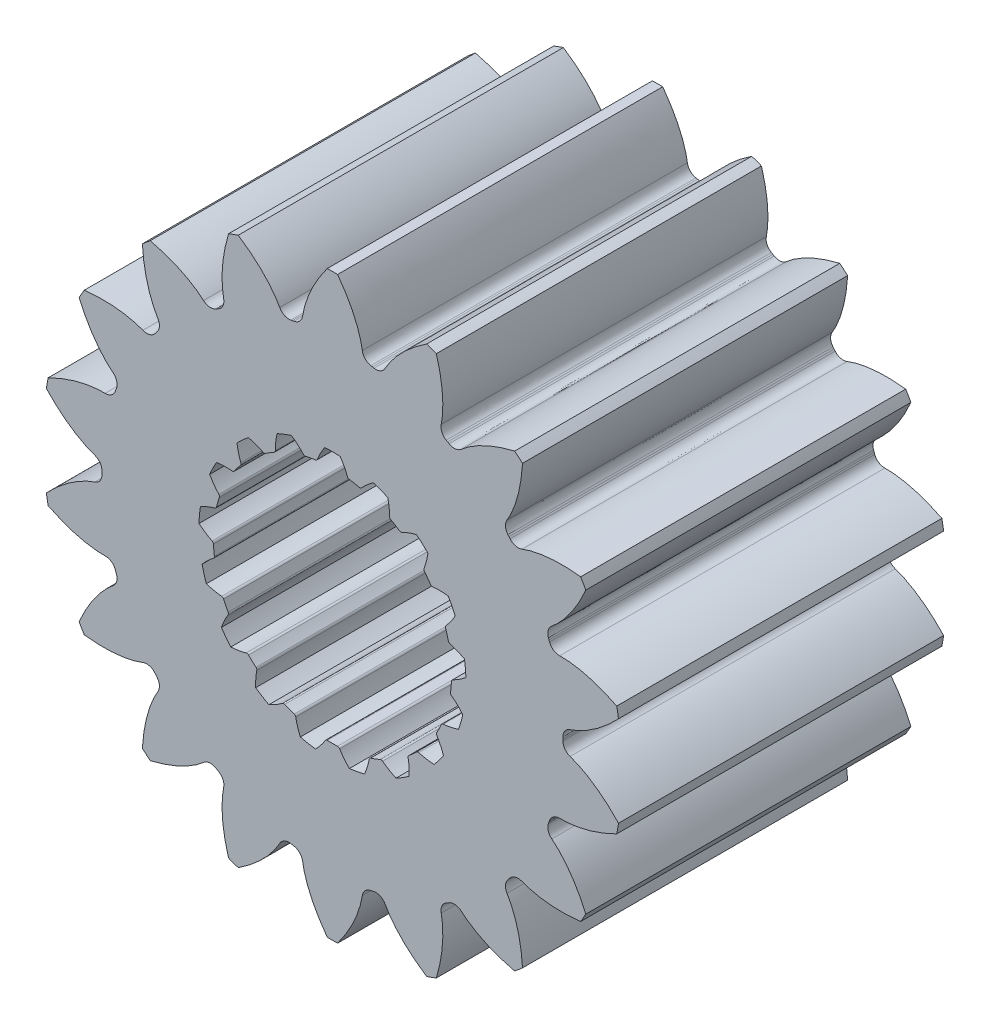
from build123d import *

# Parameters (mm, degrees)
BOSS_EXTRUDE1_DEPTH      = 9
BOSS_EXTRUDE1_DEPTH_BACK = 9
SKETCH1_R                = 16.0345
SKETCH1_R_2              = 5
CUT_EXTRUDE1_START       = -9
CUT_EXTRUDE1_DEPTH       = 18
CIRPATTERN1_COUNT        = 18
CUT_EXTRUDE2_DEPTH       = 18


with BuildPart() as part:
    # Sketch1 → Boss-Extrude1 (new, two sides: drawn at the far end of the back side and taken through both)
    with BuildSketch(Plane.XY.offset(-BOSS_EXTRUDE1_DEPTH_BACK)):
        Circle(SKETCH1_R)
        Circle(SKETCH1_R_2, mode=Mode.SUBTRACT)
    extrude(amount=BOSS_EXTRUDE1_DEPTH + BOSS_EXTRUDE1_DEPTH_BACK)

    # Sketch2 → Cut-Extrude1 (cut)
    with BuildSketch(Plane.XY.offset(CUT_EXTRUDE1_START)):
        with BuildLine():
            Line((5.214823842, 15.16280985), (5.423416795, 15.769322244))
            ThreePointArc((5.423416795, 15.769322244), (2.895736173, 16.422535912), (0.297081112, 16.673233537))
            Line((0.297081112, 16.673233537), (0.285654915, 16.031955324))
            add(Edge.make_bspline(
                [(0.285654915, 16.031955324), (0.767185844, 15.385565398), (1.123566803, 14.774160551), (1.369184958, 14.22072338), (1.523629879, 13.744240633), (1.609966452, 13.358037963), (1.652753118, 13.069342232)],
                knots=[0, 0, 0, 0, 0, 0, 0, 1, 1, 1, 1, 1, 1, 1], degree=6))
            add(Edge.make_bspline(
                [(1.652753118, 13.069342232), (1.65690486, 13.041303758), (1.668991922, 12.986299485), (1.698350668, 12.908124296), (1.737718721, 12.836284444), (1.785987822, 12.771662534), (1.84229624, 12.714839563), (1.905620083, 12.666581458), (1.974800727, 12.627632859), (2.048568857, 12.598635126), (2.099908792, 12.586265226), (2.125873398, 12.581878812)],
                knots=[0, 0, 0, 0, 0.117046642, 0.231959645, 0.343942671, 0.454480363, 0.564216465, 0.673478121, 0.782453612, 0.891264558, 1, 1, 1, 1], degree=3))
            add(Edge.make_bspline(
                [(2.125873398, 12.581878812), (2.155863162, 12.576811649), (2.185834809, 12.57163726), (2.215787573, 12.56635578)],
                knots=[0, 0, 0, 0, 1, 1, 1, 1], degree=3))
            add(Edge.make_bspline(
                [(2.215787573, 12.56635578), (2.245740337, 12.561074299), (2.275674218, 12.555685727), (2.30558845, 12.5501902)],
                knots=[0, 0, 0, 0, 1, 1, 1, 1], degree=3))
            add(Edge.make_bspline(
                [(2.30558845, 12.5501902), (2.33148744, 12.545431662), (2.383961954, 12.539496274), (2.46319913, 12.541515043), (2.541528876, 12.554453581), (2.617539067, 12.578143336), (2.689886274, 12.612280849), (2.757346386, 12.656496577), (2.818910931, 12.710539288), (2.873236618, 12.773958654), (2.90340731, 12.821511744), (2.916898394, 12.846439312)],
                knots=[0, 0, 0, 0, 0.108735442, 0.217546388, 0.326521879, 0.435783535, 0.545519637, 0.656057329, 0.768040355, 0.882953358, 1, 1, 1, 1], degree=3))
            add(Edge.make_bspline(
                [(2.916898394, 12.846439312), (3.055844464, 13.103090659), (3.269063397, 13.43647361), (3.577160847, 13.831397658), (3.997253075, 14.267452127), (4.541254406, 14.720095284), (5.214823842, 15.16280985)],
                knots=[0, 0, 0, 0, 0, 0, 0, 1, 1, 1, 1, 1, 1, 1], degree=6))
        make_face()
    cut_extrude1 = extrude(amount=CUT_EXTRUDE1_DEPTH, mode=Mode.SUBTRACT)

    # CirPattern1: Cut-Extrude1 ×18 about axis
    cirpattern1_axis = Axis((0, 0, -12.5), (0, 0, 1))
    for i in range(1, CIRPATTERN1_COUNT):
        add(cut_extrude1.rotate(cirpattern1_axis, i * 360 / CIRPATTERN1_COUNT), mode=Mode.SUBTRACT)

    # Sketch3 → Cut-Extrude2 (cut)
    with BuildSketch(Plane.XY.offset(9)):
        with BuildLine():
            ThreePointArc((3.065392679, 6.726988256), (2.670452404, 6.893309146), (2.26653836, 7.036466068))
            add(Edge.make_bspline(
                [(2.26653836, 7.036466068), (2.126776613, 6.938773232), (1.999922141, 6.840575902), (1.885666526, 6.743095462), (1.783571022, 6.647504303), (1.693075613, 6.554906138), (1.613512451, 6.466320269)],
                knots=[0, 0, 0, 0, 0, 0, 0, 1, 1, 1, 1, 1, 1, 1], degree=6))
            add(Edge.make_bspline(
                [(1.613512451, 6.466320269), (1.598123188, 6.449084984), (1.558003244, 6.423029011), (1.510179469, 6.420973803), (1.487713761, 6.426226045)],
                knots=[0, 0, 0, 0, 0.500434337, 1, 1, 1, 1], degree=3))
            ThreePointArc((1.487713761, 6.426226045), (1.350174179, 6.456524672), (1.212019072, 6.483879919))
            ThreePointArc((1.212019072, 6.483879919), (1.073311415, 6.508279292), (0.934114448, 6.529711692))
            add(Edge.make_bspline(
                [(0.934114448, 6.529711692), (0.911268471, 6.532929671), (0.867416555, 6.552122036), (0.839418325, 6.590911503), (0.831294368, 6.61254217)],
                knots=[0, 0, 0, 0, 0.499565663, 1, 1, 1, 1], degree=3))
            add(Edge.make_bspline(
                [(0.831294368, 6.61254217), (0.789104836, 6.723887562), (0.738170695, 6.842923492), (0.677500983, 6.968940743), (0.606174791, 7.101112435), (0.523359486, 7.238503839), (0.428326261, 7.380087462)],
                knots=[0, 0, 0, 0, 0, 0, 0, 1, 1, 1, 1, 1, 1, 1], degree=6))
            ThreePointArc((0.428326261, 7.380087462), (-2.6613e-05, 7.39250819), (-0.428379487, 7.380087462))
            add(Edge.make_bspline(
                [(-0.428379487, 7.380087462), (-0.523412712, 7.238503839), (-0.606228017, 7.101112435), (-0.677554209, 6.968940743), (-0.738223921, 6.842923492), (-0.789158063, 6.723887562), (-0.831347594, 6.61254217)],
                knots=[0, 0, 0, 0, 0, 0, 0, 1, 1, 1, 1, 1, 1, 1], degree=6))
            add(Edge.make_bspline(
                [(-0.831347594, 6.61254217), (-0.839471551, 6.590911503), (-0.867469782, 6.552122036), (-0.911321697, 6.532929671), (-0.934167675, 6.529711692)],
                knots=[0, 0, 0, 0, 0.500434337, 1, 1, 1, 1], degree=3))
            ThreePointArc((-0.934167675, 6.529711692), (-1.073364642, 6.508279292), (-1.212072298, 6.483879919))
            ThreePointArc((-1.212072298, 6.483879919), (-1.350227406, 6.456524672), (-1.487766988, 6.426226045))
            add(Edge.make_bspline(
                [(-1.487766988, 6.426226045), (-1.510232695, 6.420973803), (-1.55805647, 6.423029011), (-1.598176415, 6.449084984), (-1.613565678, 6.466320269)],
                knots=[0, 0, 0, 0, 0.499565663, 1, 1, 1, 1], degree=3))
            add(Edge.make_bspline(
                [(-1.613565678, 6.466320269), (-1.693128839, 6.554906138), (-1.783624249, 6.647504303), (-1.885719752, 6.743095462), (-1.999975367, 6.840575902), (-2.126829839, 6.938773232), (-2.266591586, 7.036466068)],
                knots=[0, 0, 0, 0, 0, 0, 0, 1, 1, 1, 1, 1, 1, 1], degree=6))
            ThreePointArc((-2.266591586, 7.036466068), (-2.67050563, 6.893309146), (-3.065445906, 6.726988256))
            add(Edge.make_bspline(
                [(-3.065445906, 6.726988256), (-3.102915845, 6.560635499), (-3.130507317, 6.402605491), (-3.149271088, 6.253593067), (-3.160321228, 6.114169052), (-3.164815163, 5.984771819), (-3.163933134, 5.865704717)],
                knots=[0, 0, 0, 0, 0, 0, 0, 1, 1, 1, 1, 1, 1, 1], degree=6))
            add(Edge.make_bspline(
                [(-3.163933134, 5.865704717), (-3.1636946, 5.842600008), (-3.175789801, 5.79631578), (-3.209747413, 5.762578293), (-3.229888184, 5.751324698)],
                knots=[0, 0, 0, 0, 0.500434337, 1, 1, 1, 1], degree=3))
            ThreePointArc((-3.229888184, 5.751324698), (-3.351943214, 5.681055836), (-3.472470182, 5.608197114))
            ThreePointArc((-3.472470182, 5.608197114), (-3.591414128, 5.532781724), (-3.708720842, 5.454844068))
            add(Edge.make_bspline(
                [(-3.708720842, 5.454844068), (-3.727772162, 5.441830948), (-3.773108931, 5.426471433), (-3.819932168, 5.436274908), (-3.840508331, 5.44678709)],
                knots=[0, 0, 0, 0, 0.499565663, 1, 1, 1, 1], degree=3))
            add(Edge.make_bspline(
                [(-3.840508331, 5.44678709), (-3.946699677, 5.500649424), (-4.064534449, 5.554303929), (-4.19426718, 5.60655888), (-4.336021365, 5.656182794), (-4.489782604, 5.701923957), (-4.655397275, 5.742532048)],
                knots=[0, 0, 0, 0, 0, 0, 0, 1, 1, 1, 1, 1, 1, 1], degree=6))
            ThreePointArc((-4.655397275, 5.742532048), (-4.980321659, 5.463131611), (-5.288510462, 5.165373117))
            add(Edge.make_bspline(
                [(-5.288510462, 5.165373117), (-5.263356593, 4.996718087), (-5.231997851, 4.839392304), (-5.19566505, 4.6936641), (-5.155603235, 4.559663308), (-5.113050033, 4.437380585), (-5.069215567, 4.326672444)],
                knots=[0, 0, 0, 0, 0, 0, 0, 1, 1, 1, 1, 1, 1, 1], degree=6))
            add(Edge.make_bspline(
                [(-5.069215567, 4.326672444), (-5.060646757, 4.305214113), (-5.055205405, 4.257686065), (-5.074682549, 4.213959892), (-5.089397991, 4.196190541)],
                knots=[0, 0, 0, 0, 0.500434337, 1, 1, 1, 1], degree=3))
            ThreePointArc((-5.089397991, 4.196190541), (-5.177826876, 4.086575416), (-5.26389532, 3.975097318))
            ThreePointArc((-5.26389532, 3.975097318), (-5.347564066, 3.861807052), (-5.42879499, 3.74675628))
            add(Edge.make_bspline(
                [(-5.42879499, 3.74675628), (-5.441858936, 3.727739776), (-5.478585717, 3.697039925), (-5.525788509, 3.689266889), (-5.548772648, 3.691636239)],
                knots=[0, 0, 0, 0, 0.499565663, 1, 1, 1, 1], degree=3))
            add(Edge.make_bspline(
                [(-5.548772648, 3.691636239), (-5.667250448, 3.703500632), (-5.796510343, 3.710965138), (-5.936359178, 3.71282656), (-6.086467244, 3.707891965), (-6.246368943, 3.694999362), (-6.415469359, 3.673038359)],
                knots=[0, 0, 0, 0, 0, 0, 0, 1, 1, 1, 1, 1, 1, 1], degree=6))
            ThreePointArc((-6.415469359, 3.673038359), (-6.617521245, 3.295128985), (-6.797335971, 2.906146822))
            add(Edge.make_bspline(
                [(-6.797335971, 2.906146822), (-6.712955462, 2.757967316), (-6.626881678, 2.622593476), (-6.540359251, 2.499830895), (-6.454596052, 2.389350874), (-6.370742757, 2.29069762), (-6.289875942, 2.203300189)],
                knots=[0, 0, 0, 0, 0, 0, 0, 1, 1, 1, 1, 1, 1, 1], degree=6))
            add(Edge.make_bspline(
                [(-6.289875942, 2.203300189), (-6.274134122, 2.186386302), (-6.2518911, 2.144033361), (-6.254257281, 2.096223963), (-6.261559992, 2.074338706)],
                knots=[0, 0, 0, 0, 0.500434337, 1, 1, 1, 1], degree=3))
            ThreePointArc((-6.261559992, 2.074338706), (-6.304419922, 1.940181448), (-6.344405822, 1.805139709))
            ThreePointArc((-6.344405822, 1.805139709), (-6.381499439, 1.669275045), (-6.415683888, 1.5326494))
            add(Edge.make_bspline(
                [(-6.415683888, 1.5326494), (-6.4209961, 1.510197798), (-6.444152738, 1.468303795), (-6.485360087, 1.44400404), (-6.507648066, 1.437910564)],
                knots=[0, 0, 0, 0, 0.499565663, 1, 1, 1, 1], degree=3))
            add(Edge.make_bspline(
                [(-6.507648066, 1.437910564), (-6.622411237, 1.406174663), (-6.74563899, 1.366441048), (-6.876716569, 1.317657547), (-7.01490559, 1.258830885), (-7.159352139, 1.189045735), (-7.309100351, 1.107481594)],
                knots=[0, 0, 0, 0, 0, 0, 0, 1, 1, 1, 1, 1, 1, 1], degree=6))
            ThreePointArc((-7.309100351, 1.107481594), (-7.360991511, 0.682102038), (-7.388147185, 0.254430401))
            add(Edge.make_bspline(
                [(-7.388147185, 0.254430401), (-7.255936092, 0.146738882), (-7.126772008, 0.051599973), (-7.001745288, -0.031617218), (-6.8818635, -0.10365553), (-6.768034966, -0.165355645), (-6.661057312, -0.21763886)],
                knots=[0, 0, 0, 0, 0, 0, 0, 1, 1, 1, 1, 1, 1, 1], degree=6))
            add(Edge.make_bspline(
                [(-6.661057312, -0.21763886), (-6.640268501, -0.227723988), (-6.604227854, -0.259181823), (-6.589163505, -0.304617522), (-6.588067214, -0.32766296)],
                knots=[0, 0, 0, 0, 0.500434337, 1, 1, 1, 1], degree=3))
            ThreePointArc((-6.588067214, -0.32766296), (-6.579569717, -0.46824367), (-6.568072755, -0.608610914))
            ThreePointArc((-6.568072755, -0.608610914), (-6.553581546, -0.7487007), (-6.536102719, -0.888449167))
            add(Edge.make_bspline(
                [(-6.536102719, -0.888449167), (-6.532945756, -0.911303656), (-6.539404818, -0.958733793), (-6.569051443, -0.99627845), (-6.587633147, -1.010011794)],
                knots=[0, 0, 0, 0, 0.499565663, 1, 1, 1, 1], degree=3))
            add(Edge.make_bspline(
                [(-6.587633147, -1.010011794), (-6.683182287, -1.08106188), (-6.783735307, -1.162627371), (-6.888338876, -1.255467314), (-6.995945659, -1.360241175), (-7.105428751, -1.477494001), (-7.215600434, -1.607645592)],
                knots=[0, 0, 0, 0, 0, 0, 0, 1, 1, 1, 1, 1, 1, 1], degree=6))
            ThreePointArc((-7.215600434, -1.607645592), (-7.11032268, -2.023045464), (-6.981151778, -2.431647149))
            add(Edge.make_bspline(
                [(-6.981151778, -2.431647149), (-6.818965941, -2.484306344), (-6.664155882, -2.526361286), (-6.51751042, -2.558794145), (-6.379700742, -2.582661573), (-6.251270143, -2.599075608), (-6.132629576, -2.609183468)],
                knots=[0, 0, 0, 0, 0, 0, 0, 1, 1, 1, 1, 1, 1, 1], degree=6))
            add(Edge.make_bspline(
                [(-6.132629576, -2.609183468), (-6.109601419, -2.611077785), (-6.064630636, -2.62739196), (-6.034170281, -2.664317617), (-6.024823047, -2.685410822)],
                knots=[0, 0, 0, 0, 0.500434337, 1, 1, 1, 1], degree=3))
            ThreePointArc((-6.024823047, -2.685410822), (-5.966115757, -2.813428779), (-5.904688663, -2.940164155))
            ThreePointArc((-5.904688663, -2.940164155), (-5.840569745, -3.065559161), (-5.773788255, -3.189556645))
            add(Edge.make_bspline(
                [(-5.773788255, -3.189556645), (-5.762588481, -3.209727395), (-5.751477636, -3.256287962), (-5.765559595, -3.302006909), (-5.777925462, -3.321525357)],
                knots=[0, 0, 0, 0, 0.499565663, 1, 1, 1, 1], degree=3))
            add(Edge.make_bspline(
                [(-5.777925462, -3.321525357), (-5.84135613, -3.422293919), (-5.905654175, -3.534675416), (-5.969656442, -3.659033251), (-6.032148096, -3.79560402), (-6.091881432, -3.944488879), (-6.14759729, -4.105650225)],
                knots=[0, 0, 0, 0, 0, 0, 0, 1, 1, 1, 1, 1, 1, 1], degree=6))
            ThreePointArc((-6.14759729, -4.105650225), (-5.899368966, -4.454968359), (-5.631316733, -4.789316172))
            add(Edge.make_bspline(
                [(-5.631316733, -4.789316172), (-5.461060249, -4.779831127), (-5.30151217, -4.763122348), (-5.15305325, -4.740390638), (-5.015927643, -4.712863754), (-4.890240242, -4.681774902), (-4.775959828, -4.648342285)],
                knots=[0, 0, 0, 0, 0, 0, 0, 1, 1, 1, 1, 1, 1, 1], degree=6))
            add(Edge.make_bspline(
                [(-4.775959828, -4.648342285), (-4.753802405, -4.641789953), (-4.705975039, -4.640757147), (-4.664232518, -4.664185747), (-4.647896738, -4.680477965)],
                knots=[0, 0, 0, 0, 0.500434337, 1, 1, 1, 1], degree=3))
            ThreePointArc((-4.647896738, -4.680477965), (-4.5469084, -4.778643636), (-4.443847242, -4.874630828))
            ThreePointArc((-4.443847242, -4.874630828), (-4.33876023, -4.968395765), (-4.231695288, -5.059895719))
            add(Edge.make_bspline(
                [(-4.231695288, -5.059895719), (-4.213965295, -5.074658557), (-4.186785123, -5.114061293), (-4.18340057, -5.161779932), (-4.187880522, -5.184447408)],
                knots=[0, 0, 0, 0, 0.499565663, 1, 1, 1, 1], degree=3))
            add(Edge.make_bspline(
                [(-4.187880522, -5.184447408), (-4.210626055, -5.301325095), (-4.229985317, -5.429344852), (-4.244742422, -5.568425366), (-4.253679101, -5.718348405), (-4.255595364, -5.878757571), (-4.249330661, -6.04916294)],
                knots=[0, 0, 0, 0, 0, 0, 0, 1, 1, 1, 1, 1, 1, 1], degree=6))
            ThreePointArc((-4.249330661, -6.04916294), (-3.891676377, -6.285221986), (-3.520944753, -6.5001604))
            add(Edge.make_bspline(
                [(-3.520944753, -6.5001604), (-3.365611703, -6.429812124), (-3.222873458, -6.356596238), (-3.092651278, -6.281770002), (-2.974729315, -6.206566464), (-2.868759893, -6.132173446), (-2.774273835, -6.059715612)],
                knots=[0, 0, 0, 0, 0, 0, 0, 1, 1, 1, 1, 1, 1, 1], degree=6))
            add(Edge.make_bspline(
                [(-2.774273835, -6.059715612), (-2.755979628, -6.04560156), (-2.71175503, -6.02736126), (-2.664367902, -6.034128641), (-2.643249813, -6.043419517)],
                knots=[0, 0, 0, 0, 0.500434337, 1, 1, 1, 1], degree=3))
            ThreePointArc((-2.643249813, -6.043419517), (-2.513619462, -6.098475084), (-2.382843221, -6.150750491))
            ThreePointArc((-2.382843221, -6.150750491), (-2.250980699, -6.200221883), (-2.118092018, -6.246866731))
            add(Edge.make_bspline(
                [(-2.118092018, -6.246866731), (-2.096226339, -6.254227856), (-2.056647673, -6.281151202), (-2.036253712, -6.324424866), (-2.032242705, -6.347180004)],
                knots=[0, 0, 0, 0, 0.499565663, 1, 1, 1, 1], degree=3))
            add(Edge.make_bspline(
                [(-2.032242705, -6.347180004), (-2.011231193, -6.464381835), (-1.983037097, -6.590750076), (-1.94655601, -6.725769674), (-1.900730767, -6.868797045), (-1.844571155, -7.019066371), (-1.777171973, -7.175701574)],
                knots=[0, 0, 0, 0, 0, 0, 0, 1, 1, 1, 1, 1, 1, 1], degree=6))
            ThreePointArc((-1.777171973, -7.175701574), (-1.358394924, -7.266620449), (-0.935053268, -7.333120842))
            add(Edge.make_bspline(
                [(-0.935053268, -7.333120842), (-0.815622242, -7.211410258), (-0.708971421, -7.091575476), (-0.614573208, -6.974760412), (-0.531780904, -6.862036875), (-0.459841219, -6.754386881), (-0.397910382, -6.652689663)],
                knots=[0, 0, 0, 0, 0, 0, 0, 1, 1, 1, 1, 1, 1, 1], degree=6))
            add(Edge.make_bspline(
                [(-0.397910382, -6.652689663), (-0.385950126, -6.632920071), (-0.351301073, -6.59993573), (-0.304669232, -6.58912792), (-0.281620948, -6.59016267)],
                knots=[0, 0, 0, 0, 0.500434337, 1, 1, 1, 1], degree=3))
            ThreePointArc((-0.281620948, -6.59016267), (-0.140855881, -6.594672573), (-2.6613e-05, -6.596176111))
            ThreePointArc((-2.6613e-05, -6.596176111), (0.140802655, -6.594672573), (0.281567722, -6.59016267))
            add(Edge.make_bspline(
                [(0.281567722, -6.59016267), (0.304616005, -6.58912792), (0.351247846, -6.59993573), (0.3858969, -6.632920071), (0.397857156, -6.652689663)],
                knots=[0, 0, 0, 0, 0.499565663, 1, 1, 1, 1], degree=3))
            add(Edge.make_bspline(
                [(0.397857156, -6.652689663), (0.459787992, -6.754386881), (0.531727678, -6.862036875), (0.614519982, -6.974760412), (0.708918194, -7.091575476), (0.815569016, -7.211410258), (0.935000042, -7.333120842)],
                knots=[0, 0, 0, 0, 0, 0, 0, 1, 1, 1, 1, 1, 1, 1], degree=6))
            ThreePointArc((0.935000042, -7.333120842), (1.358341697, -7.266620449), (1.777118747, -7.175701574))
            add(Edge.make_bspline(
                [(1.777118747, -7.175701574), (1.844517928, -7.019066371), (1.900677541, -6.868797045), (1.946502784, -6.725769674), (1.98298387, -6.590750076), (2.011177966, -6.464381835), (2.032189479, -6.347180004)],
                knots=[0, 0, 0, 0, 0, 0, 0, 1, 1, 1, 1, 1, 1, 1], degree=6))
            add(Edge.make_bspline(
                [(2.032189479, -6.347180004), (2.036200485, -6.324424866), (2.056594447, -6.281151202), (2.096173113, -6.254227856), (2.118038791, -6.246866731)],
                knots=[0, 0, 0, 0, 0.500434337, 1, 1, 1, 1], degree=3))
            ThreePointArc((2.118038791, -6.246866731), (2.250927472, -6.200221883), (2.382789994, -6.150750491))
            ThreePointArc((2.382789994, -6.150750491), (2.513566235, -6.098475084), (2.643196586, -6.043419517))
            add(Edge.make_bspline(
                [(2.643196586, -6.043419517), (2.664314676, -6.034128641), (2.711701804, -6.02736126), (2.755926402, -6.04560156), (2.774220609, -6.059715612)],
                knots=[0, 0, 0, 0, 0.499565663, 1, 1, 1, 1], degree=3))
            add(Edge.make_bspline(
                [(2.774220609, -6.059715612), (2.868706667, -6.132173446), (2.974676089, -6.206566464), (3.092598052, -6.281770002), (3.222820232, -6.356596238), (3.365558477, -6.429812124), (3.520891526, -6.5001604)],
                knots=[0, 0, 0, 0, 0, 0, 0, 1, 1, 1, 1, 1, 1, 1], degree=6))
            ThreePointArc((3.520891526, -6.5001604), (3.891623151, -6.285221986), (4.249277434, -6.04916294))
            add(Edge.make_bspline(
                [(4.249277434, -6.04916294), (4.255542137, -5.878757571), (4.253625875, -5.718348405), (4.244689195, -5.568425366), (4.229932091, -5.429344852), (4.210572828, -5.301325095), (4.187827295, -5.184447408)],
                knots=[0, 0, 0, 0, 0, 0, 0, 1, 1, 1, 1, 1, 1, 1], degree=6))
            add(Edge.make_bspline(
                [(4.187827295, -5.184447408), (4.183347344, -5.161779932), (4.186731896, -5.114061293), (4.213912068, -5.074658557), (4.231642062, -5.059895719)],
                knots=[0, 0, 0, 0, 0.500434337, 1, 1, 1, 1], degree=3))
            ThreePointArc((4.231642062, -5.059895719), (4.338707004, -4.968395765), (4.443794016, -4.874630828))
            ThreePointArc((4.443794016, -4.874630828), (4.546855173, -4.778643636), (4.647843511, -4.680477965))
            add(Edge.make_bspline(
                [(4.647843511, -4.680477965), (4.664179291, -4.664185747), (4.705921812, -4.640757147), (4.753749178, -4.641789953), (4.775906602, -4.648342285)],
                knots=[0, 0, 0, 0, 0.499565663, 1, 1, 1, 1], degree=3))
            add(Edge.make_bspline(
                [(4.775906602, -4.648342285), (4.890187016, -4.681774902), (5.015874416, -4.712863754), (5.153000023, -4.740390638), (5.301458944, -4.763122348), (5.461007022, -4.779831127), (5.631263506, -4.789316172)],
                knots=[0, 0, 0, 0, 0, 0, 0, 1, 1, 1, 1, 1, 1, 1], degree=6))
            ThreePointArc((5.631263506, -4.789316172), (5.899315739, -4.454968359), (6.147544063, -4.105650225))
            add(Edge.make_bspline(
                [(6.147544063, -4.105650225), (6.091828206, -3.944488879), (6.03209487, -3.79560402), (5.969603216, -3.659033251), (5.905600949, -3.534675416), (5.841302904, -3.422293919), (5.777872236, -3.321525357)],
                knots=[0, 0, 0, 0, 0, 0, 0, 1, 1, 1, 1, 1, 1, 1], degree=6))
            add(Edge.make_bspline(
                [(5.777872236, -3.321525357), (5.765506368, -3.302006909), (5.751424409, -3.256287962), (5.762535255, -3.209727395), (5.773735029, -3.189556645)],
                knots=[0, 0, 0, 0, 0.500434337, 1, 1, 1, 1], degree=3))
            ThreePointArc((5.773735029, -3.189556645), (5.840516518, -3.065559161), (5.904635437, -2.940164155))
            ThreePointArc((5.904635437, -2.940164155), (5.966062531, -2.813428779), (6.024769821, -2.685410822))
            add(Edge.make_bspline(
                [(6.024769821, -2.685410822), (6.034117054, -2.664317617), (6.064577409, -2.62739196), (6.109548193, -2.611077785), (6.13257635, -2.609183468)],
                knots=[0, 0, 0, 0, 0.499565663, 1, 1, 1, 1], degree=3))
            add(Edge.make_bspline(
                [(6.13257635, -2.609183468), (6.251216917, -2.599075608), (6.379647516, -2.582661573), (6.517457194, -2.558794145), (6.664102655, -2.526361286), (6.818912715, -2.484306344), (6.981098551, -2.431647149)],
                knots=[0, 0, 0, 0, 0, 0, 0, 1, 1, 1, 1, 1, 1, 1], degree=6))
            ThreePointArc((6.981098551, -2.431647149), (7.110269454, -2.023045464), (7.215547208, -1.607645592))
            add(Edge.make_bspline(
                [(7.215547208, -1.607645592), (7.105375525, -1.477494001), (6.995892433, -1.360241175), (6.888285649, -1.255467314), (6.783682081, -1.162627371), (6.683129061, -1.08106188), (6.587579921, -1.010011794)],
                knots=[0, 0, 0, 0, 0, 0, 0, 1, 1, 1, 1, 1, 1, 1], degree=6))
            add(Edge.make_bspline(
                [(6.587579921, -1.010011794), (6.568998216, -0.99627845), (6.539351592, -0.958733793), (6.53289253, -0.911303656), (6.536049493, -0.888449167)],
                knots=[0, 0, 0, 0, 0.500434337, 1, 1, 1, 1], degree=3))
            ThreePointArc((6.536049493, -0.888449167), (6.553528319, -0.7487007), (6.568019529, -0.608610914))
            ThreePointArc((6.568019529, -0.608610914), (6.57951649, -0.46824367), (6.588013988, -0.32766296))
            add(Edge.make_bspline(
                [(6.588013988, -0.32766296), (6.589110279, -0.304617522), (6.604174628, -0.259181823), (6.640215275, -0.227723988), (6.661004086, -0.21763886)],
                knots=[0, 0, 0, 0, 0.499565663, 1, 1, 1, 1], degree=3))
            add(Edge.make_bspline(
                [(6.661004086, -0.21763886), (6.767981739, -0.165355645), (6.881810273, -0.10365553), (7.001692062, -0.031617218), (7.126718782, 0.051599973), (7.255882866, 0.146738882), (7.388093959, 0.254430401)],
                knots=[0, 0, 0, 0, 0, 0, 0, 1, 1, 1, 1, 1, 1, 1], degree=6))
            ThreePointArc((7.388093959, 0.254430401), (7.360938285, 0.682102038), (7.309047125, 1.107481594))
            add(Edge.make_bspline(
                [(7.309047125, 1.107481594), (7.159298913, 1.189045735), (7.014852364, 1.258830885), (6.876663342, 1.317657547), (6.745585764, 1.366441048), (6.622358011, 1.406174663), (6.50759484, 1.437910564)],
                knots=[0, 0, 0, 0, 0, 0, 0, 1, 1, 1, 1, 1, 1, 1], degree=6))
            add(Edge.make_bspline(
                [(6.50759484, 1.437910564), (6.48530686, 1.44400404), (6.444099512, 1.468303795), (6.420942874, 1.510197798), (6.415630661, 1.5326494)],
                knots=[0, 0, 0, 0, 0.500434337, 1, 1, 1, 1], degree=3))
            ThreePointArc((6.415630661, 1.5326494), (6.381446212, 1.669275045), (6.344352595, 1.805139709))
            ThreePointArc((6.344352595, 1.805139709), (6.304366695, 1.940181448), (6.261506766, 2.074338706))
            add(Edge.make_bspline(
                [(6.261506766, 2.074338706), (6.254204054, 2.096223963), (6.251837874, 2.144033361), (6.274080895, 2.186386302), (6.289822716, 2.203300189)],
                knots=[0, 0, 0, 0, 0.499565663, 1, 1, 1, 1], degree=3))
            add(Edge.make_bspline(
                [(6.289822716, 2.203300189), (6.370689531, 2.29069762), (6.454542825, 2.389350874), (6.540306025, 2.499830895), (6.626828452, 2.622593476), (6.712902236, 2.757967316), (6.797282745, 2.906146822)],
                knots=[0, 0, 0, 0, 0, 0, 0, 1, 1, 1, 1, 1, 1, 1], degree=6))
            ThreePointArc((6.797282745, 2.906146822), (6.617468018, 3.295128985), (6.415416133, 3.673038359))
            add(Edge.make_bspline(
                [(6.415416133, 3.673038359), (6.246315717, 3.694999362), (6.086414018, 3.707891965), (5.936305951, 3.71282656), (5.796457117, 3.710965138), (5.667197222, 3.703500632), (5.548719422, 3.691636239)],
                knots=[0, 0, 0, 0, 0, 0, 0, 1, 1, 1, 1, 1, 1, 1], degree=6))
            add(Edge.make_bspline(
                [(5.548719422, 3.691636239), (5.525735282, 3.689266889), (5.478532491, 3.697039925), (5.441805709, 3.727739776), (5.428741764, 3.74675628)],
                knots=[0, 0, 0, 0, 0.500434337, 1, 1, 1, 1], degree=3))
            ThreePointArc((5.428741764, 3.74675628), (5.347510839, 3.861807052), (5.263842094, 3.975097318))
            ThreePointArc((5.263842094, 3.975097318), (5.17777365, 4.086575416), (5.089344764, 4.196190541))
            add(Edge.make_bspline(
                [(5.089344764, 4.196190541), (5.074629322, 4.213959892), (5.055152178, 4.257686065), (5.060593531, 4.305214113), (5.069162341, 4.326672444)],
                knots=[0, 0, 0, 0, 0.499565663, 1, 1, 1, 1], degree=3))
            add(Edge.make_bspline(
                [(5.069162341, 4.326672444), (5.112996806, 4.437380585), (5.155550009, 4.559663308), (5.195611823, 4.6936641), (5.231944625, 4.839392304), (5.263303366, 4.996718087), (5.288457236, 5.165373117)],
                knots=[0, 0, 0, 0, 0, 0, 0, 1, 1, 1, 1, 1, 1, 1], degree=6))
            ThreePointArc((5.288457236, 5.165373117), (4.980268432, 5.463131611), (4.655344049, 5.742532048))
            add(Edge.make_bspline(
                [(4.655344049, 5.742532048), (4.489729377, 5.701923957), (4.335968138, 5.656182794), (4.194213954, 5.60655888), (4.064481222, 5.554303929), (3.94664645, 5.500649424), (3.840455105, 5.44678709)],
                knots=[0, 0, 0, 0, 0, 0, 0, 1, 1, 1, 1, 1, 1, 1], degree=6))
            add(Edge.make_bspline(
                [(3.840455105, 5.44678709), (3.819878941, 5.436274908), (3.773055705, 5.426471433), (3.727718935, 5.441830948), (3.708667616, 5.454844068)],
                knots=[0, 0, 0, 0, 0.500434337, 1, 1, 1, 1], degree=3))
            ThreePointArc((3.708667616, 5.454844068), (3.591360902, 5.532781724), (3.472416955, 5.608197114))
            ThreePointArc((3.472416955, 5.608197114), (3.351889988, 5.681055836), (3.229834958, 5.751324698))
            add(Edge.make_bspline(
                [(3.229834958, 5.751324698), (3.209694186, 5.762578293), (3.175736575, 5.79631578), (3.163641374, 5.842600008), (3.163879908, 5.865704717)],
                knots=[0, 0, 0, 0, 0.499565663, 1, 1, 1, 1], degree=3))
            add(Edge.make_bspline(
                [(3.163879908, 5.865704717), (3.164761936, 5.984771819), (3.160268002, 6.114169052), (3.149217861, 6.253593067), (3.130454091, 6.402605491), (3.102862619, 6.560635499), (3.065392679, 6.726988256)],
                knots=[0, 0, 0, 0, 0, 0, 0, 1, 1, 1, 1, 1, 1, 1], degree=6))
        make_face()
    extrude(amount=-CUT_EXTRUDE2_DEPTH, mode=Mode.SUBTRACT)


solid = part.part
